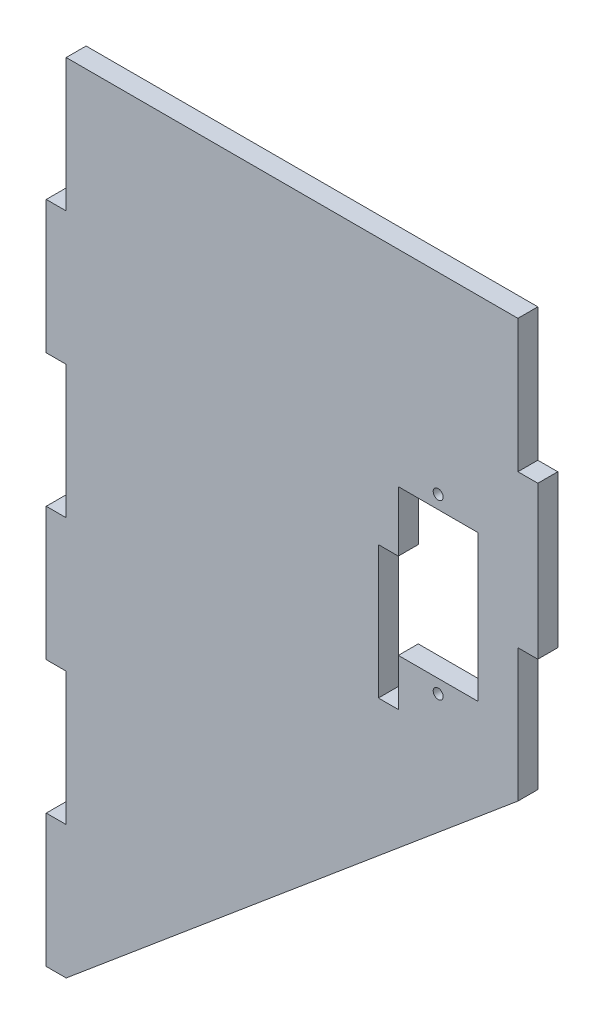
from build123d import *

# Parameters (mm, degrees)
SKETCH1_R           = 0.75
BOSS_EXTRUDE1_DEPTH = 3


with BuildPart() as part:
    # Sketch1 → Boss-Extrude1 (new body)
    with BuildSketch(Plane.XY):
        Polygon((-3, 60), (-3, 40), (0, 40), (0, 20), (-3, 20), (-3, 0), (0, 0), (68, 57.05877492), (68, 77.05877492), (71, 77.05877492), (71, 100), (68, 100), (68, 120), (23.5, 120), (0, 120), (0, 100), (-3, 100), (-3, 80), (0, 80), (0, 60), align=None)
        with Locations((56, 91.05877492)):
            Circle(SKETCH1_R, mode=Mode.SUBTRACT)
        with Locations(Location((56, 65.05877492, 0), (0, 0, 180))):
            Circle(SKETCH1_R, mode=Mode.SUBTRACT)
        Polygon((47, 80), (50, 80), (50, 89.05877492), (62, 89.05877492), (62, 67.05877492), (50, 67.05877492), (50, 60), (47, 60), align=None, mode=Mode.SUBTRACT)
    extrude(amount=BOSS_EXTRUDE1_DEPTH)


solid = part.part
